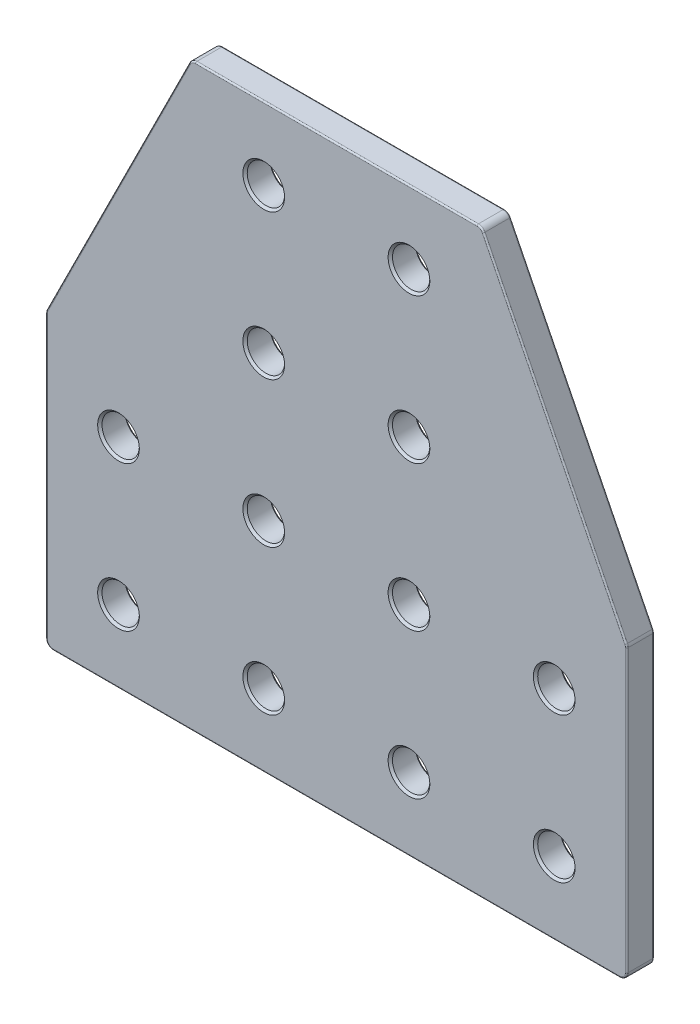
from build123d import *

# Parameters (mm, degrees)
BOSS_EXTRUDE1_START = 2.3876
SKETCH3_R           = 3.2639
BOSS_EXTRUDE1_DEPTH = 4.7752
FILLET1_R           = 1.27
CHAMFER1_SIZE       = 0.381
FILLET2_R           = 0.254


with BuildPart() as part:
    # Sketch3 → Boss-Extrude1 (new body)
    with BuildSketch(Plane.XY.offset(BOSS_EXTRUDE1_START)):
        Polygon((25.4, 50.8), (50.8, 0), (50.8, -50.8), (-50.8, -50.8), (-50.8, 0), (-25.4, 50.8), align=None)
        with Locations((-38.1, -38.1)):
            Circle(SKETCH3_R, mode=Mode.SUBTRACT)
        with Locations((-12.7, -38.1)):
            Circle(SKETCH3_R, mode=Mode.SUBTRACT)
        with Locations((12.7, -38.1)):
            Circle(SKETCH3_R, mode=Mode.SUBTRACT)
        with Locations((38.1, -38.1)):
            Circle(SKETCH3_R, mode=Mode.SUBTRACT)
        with Locations((-12.7, -12.7)):
            Circle(SKETCH3_R, mode=Mode.SUBTRACT)
        with Locations((12.7, -12.7)):
            Circle(SKETCH3_R, mode=Mode.SUBTRACT)
        with Locations((38.1, -12.7)):
            Circle(SKETCH3_R, mode=Mode.SUBTRACT)
        with Locations((-12.7, 12.7)):
            Circle(SKETCH3_R, mode=Mode.SUBTRACT)
        with Locations((12.7, 12.7)):
            Circle(SKETCH3_R, mode=Mode.SUBTRACT)
        with Locations((-12.7, 38.1)):
            Circle(SKETCH3_R, mode=Mode.SUBTRACT)
        with Locations((12.7, 38.1)):
            Circle(SKETCH3_R, mode=Mode.SUBTRACT)
        with Locations((-38.1, -12.7)):
            Circle(SKETCH3_R, mode=Mode.SUBTRACT)
    extrude(amount=-BOSS_EXTRUDE1_DEPTH)

    # Fillet1
    fillet1_edges = [part.edges().sort_by_distance(p)[0] for p in [
        (25.4, 50.8, 0),
        (50.8, 0, 0),
        (50.8, -50.8, 0),
        (-50.8, -50.8, 0),
        (-50.8, 0, 0),
        (-25.4, 50.8, 0),
    ]]
    fillet(fillet1_edges, radius=FILLET1_R)

    # Chamfer1
    chamfer1_edges = [part.edges().sort_by_distance(p)[0] for p in [
        (-41.3639, -38.1, -2.3876),
        (-41.3639, -38.1, 2.3876),
        (-15.9639, -38.1, -2.3876),
        (-15.9639, -38.1, 2.3876),
        (9.4361, -38.1, -2.3876),
        (9.4361, -38.1, 2.3876),
        (34.8361, -38.1, -2.3876),
        (34.8361, -38.1, 2.3876),
        (-15.9639, -12.7, -2.3876),
        (-15.9639, -12.7, 2.3876),
        (9.4361, -12.7, -2.3876),
        (9.4361, -12.7, 2.3876),
        (34.8361, -12.7, -2.3876),
        (34.8361, -12.7, 2.3876),
        (-15.9639, 12.7, -2.3876),
        (-15.9639, 12.7, 2.3876),
        (9.4361, 12.7, -2.3876),
        (9.4361, 12.7, 2.3876),
        (-15.9639, 38.1, -2.3876),
        (-15.9639, 38.1, 2.3876),
        (9.4361, 38.1, -2.3876),
        (9.4361, 38.1, 2.3876),
        (-41.3639, -12.7, -2.3876),
        (-41.3639, -12.7, 2.3876),
    ]]
    chamfer(chamfer1_edges, length=CHAMFER1_SIZE)

    # Fillet2
    fillet2_edges = [part.edges().sort_by_distance(p)[0] for p in [
        (0, 50.8, 2.3876),
        (0, 50.8, -2.3876),
        (-38.20847095, 25.183058101, 2.3876),
        (-50.8, -24.914903166, 2.3876),
        (0, -50.8, 2.3876),
        (50.8, -24.914903166, 2.3876),
        (38.20847095, 25.183058101, 2.3876),
        (50.766026217, -0.008020122, 2.3876),
        (50.428025612, -50.428025612, 2.3876),
        (25.282775347, 50.610326527, 2.3876),
        (-50.428025612, -50.428025612, 2.3876),
        (-50.766026217, -0.008020122, 2.3876),
        (-25.282775347, 50.610326527, 2.3876),
        (-38.20847095, 25.183058101, -2.3876),
        (38.20847095, 25.183058101, -2.3876),
        (50.8, -24.914903166, -2.3876),
        (0, -50.8, -2.3876),
        (-50.8, -24.914903166, -2.3876),
        (50.766026217, -0.008020122, -2.3876),
        (50.428025612, -50.428025612, -2.3876),
        (25.282775347, 50.610326527, -2.3876),
        (-50.428025612, -50.428025612, -2.3876),
        (-50.766026217, -0.008020122, -2.3876),
        (-25.282775347, 50.610326527, -2.3876),
    ]]
    fillet(fillet2_edges, radius=FILLET2_R)


solid = part.part
